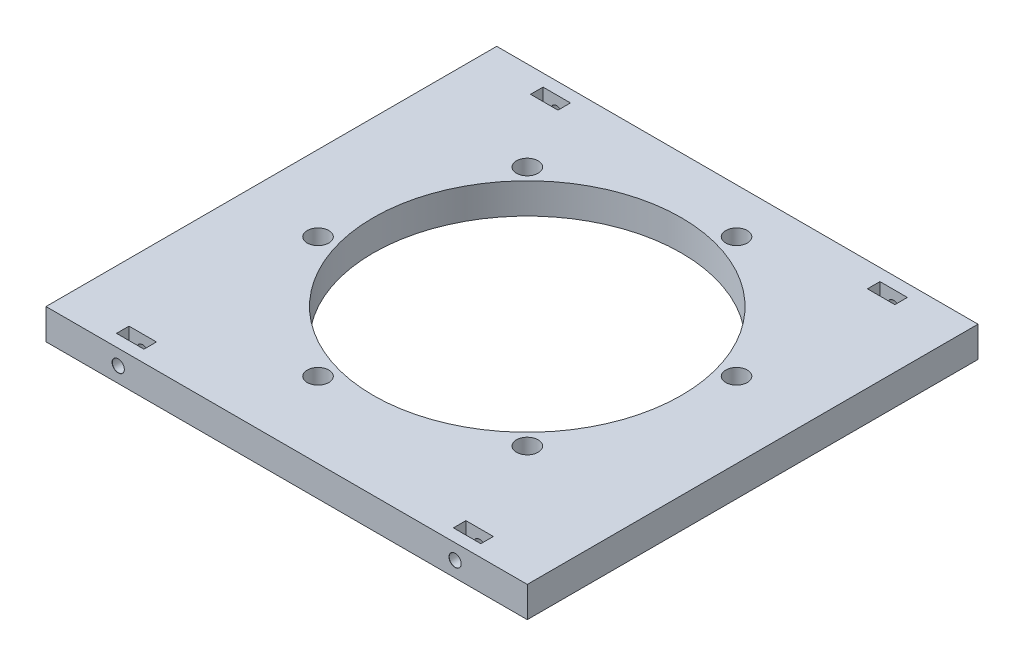
from build123d import *

# Parameters (mm, degrees)
SKETCH1_W                             = 100
SKETCH1_H                             = 100
SKETCH1_R                             = 32
BOSS_EXTRUDE3_DEPTH                   = 6.35
M4_CLEARANCE_HOLE2_D                  = 4.5
M4_CLEARANCE_HOLE2_CSINK_D            = 4.55
M4_CLEARANCE_HOLE2_CSINK_ANGLE        = 90
TAP_DRILL_FOR_M3X0_5_TAP2_D           = 2.5
TAP_DRILL_FOR_M3X0_5_TAP2_DEPTH       = 9.248924226
TAP_DRILL_FOR_M3X0_5_TAP2_CSINK_D     = 2.55
TAP_DRILL_FOR_M3X0_5_TAP2_CSINK_ANGLE = 90
TAP_DRILL_FOR_M3X0_5_TAP2_TIP         = 0.751075774
SKETCH32_W                            = 100
SKETCH32_H                            = 6.35
CUT_EXTRUDE1_DEPTH                    = 10
TAP_DRILL_FOR_M3X0_5_TAP4_D           = 2.5
TAP_DRILL_FOR_M3X0_5_TAP4_DEPTH       = 9.248924226
TAP_DRILL_FOR_M3X0_5_TAP4_CSINK_D     = 2.55
TAP_DRILL_FOR_M3X0_5_TAP4_CSINK_ANGLE = 90
TAP_DRILL_FOR_M3X0_5_TAP4_TIP         = 0.751075774
SKETCH36_W                            = 5.7
SKETCH36_H                            = 2.6
CUT_EXTRUDE2_DEPTH                    = 71.995228713


with BuildPart() as part:
    # Sketch1 → Boss-Extrude3 (new body)
    with BuildSketch(Plane(origin=(0, 0, 0), x_dir=(1, 0, 0), z_dir=(0, 1, 0))):
        Rectangle(SKETCH1_W, SKETCH1_H)
        with Locations(Location((0, 0, 0), (0, 0, 270))):
            Circle(SKETCH1_R, mode=Mode.SUBTRACT)
    extrude(amount=BOSS_EXTRUDE3_DEPTH)

    # M4 Clearance Hole2 (through all)
    with Locations(Plane(origin=(0, 0, 0), x_dir=(-1, 0, 0), z_dir=(0, -1, 0))):
        with Locations((-9.188076101, 34.290366833), (25.102290732, 25.102290732), (34.290366833, -9.188076101), (9.188076101, -34.290366833), (-25.102290732, -25.102290732), (-34.290366833, 9.188076101)):
            CounterSinkHole(M4_CLEARANCE_HOLE2_D / 2, M4_CLEARANCE_HOLE2_CSINK_D / 2, counter_sink_angle=M4_CLEARANCE_HOLE2_CSINK_ANGLE)

    # Tap Drill for M3x0.5 Tap2
    with Locations(Plane.XY.offset(50)):
        with Locations((-35, 3.175), (35, 3.175)):
            CounterSinkHole(TAP_DRILL_FOR_M3X0_5_TAP2_D / 2, TAP_DRILL_FOR_M3X0_5_TAP2_CSINK_D / 2, depth=TAP_DRILL_FOR_M3X0_5_TAP2_DEPTH, counter_sink_angle=TAP_DRILL_FOR_M3X0_5_TAP2_CSINK_ANGLE)
            with Locations((0, 0, -(TAP_DRILL_FOR_M3X0_5_TAP2_DEPTH + TAP_DRILL_FOR_M3X0_5_TAP2_TIP / 2))):  # 118° drill point
                Cone(0, TAP_DRILL_FOR_M3X0_5_TAP2_D / 2, TAP_DRILL_FOR_M3X0_5_TAP2_TIP, mode=Mode.SUBTRACT)

    # Sketch32 → Cut-Extrude1 (cut)
    with BuildSketch(Plane(origin=(0, 6.35, 0), x_dir=(1, 0, 0), z_dir=(0, 1, 0))):
        with Locations((0, 46.825)):
            Rectangle(SKETCH32_W, SKETCH32_H)
    extrude(amount=-CUT_EXTRUDE1_DEPTH, mode=Mode.SUBTRACT)

    # Tap Drill for M3x0.5 Tap4
    with Locations(Plane(origin=(0, 0, -43.65), x_dir=(-1, 0, 0), z_dir=(0, 0, -1))):
        with Locations((-35, 3.175), (35, 3.175)):
            CounterSinkHole(TAP_DRILL_FOR_M3X0_5_TAP4_D / 2, TAP_DRILL_FOR_M3X0_5_TAP4_CSINK_D / 2, depth=TAP_DRILL_FOR_M3X0_5_TAP4_DEPTH, counter_sink_angle=TAP_DRILL_FOR_M3X0_5_TAP4_CSINK_ANGLE)
            with Locations((0, 0, -(TAP_DRILL_FOR_M3X0_5_TAP4_DEPTH + TAP_DRILL_FOR_M3X0_5_TAP4_TIP / 2))):  # 118° drill point
                Cone(0, TAP_DRILL_FOR_M3X0_5_TAP4_D / 2, TAP_DRILL_FOR_M3X0_5_TAP4_TIP, mode=Mode.SUBTRACT)

    # Sketch36 → Cut-Extrude2 (cut, through all)
    with BuildSketch(Plane(origin=(0, 6.35, 0), x_dir=(1, 0, 0), z_dir=(0, 1, 0))):
        with Locations((-35, -46.2)):
            Rectangle(SKETCH36_W, SKETCH36_H)
        with Locations((35, -46.2)):
            Rectangle(SKETCH36_W, SKETCH36_H)
        with Locations((35, 39.825)):
            Rectangle(SKETCH36_W, SKETCH36_H)
        with Locations((-35, 39.825)):
            Rectangle(SKETCH36_W, SKETCH36_H)
    extrude(amount=-CUT_EXTRUDE2_DEPTH, mode=Mode.SUBTRACT)


solid = part.part
